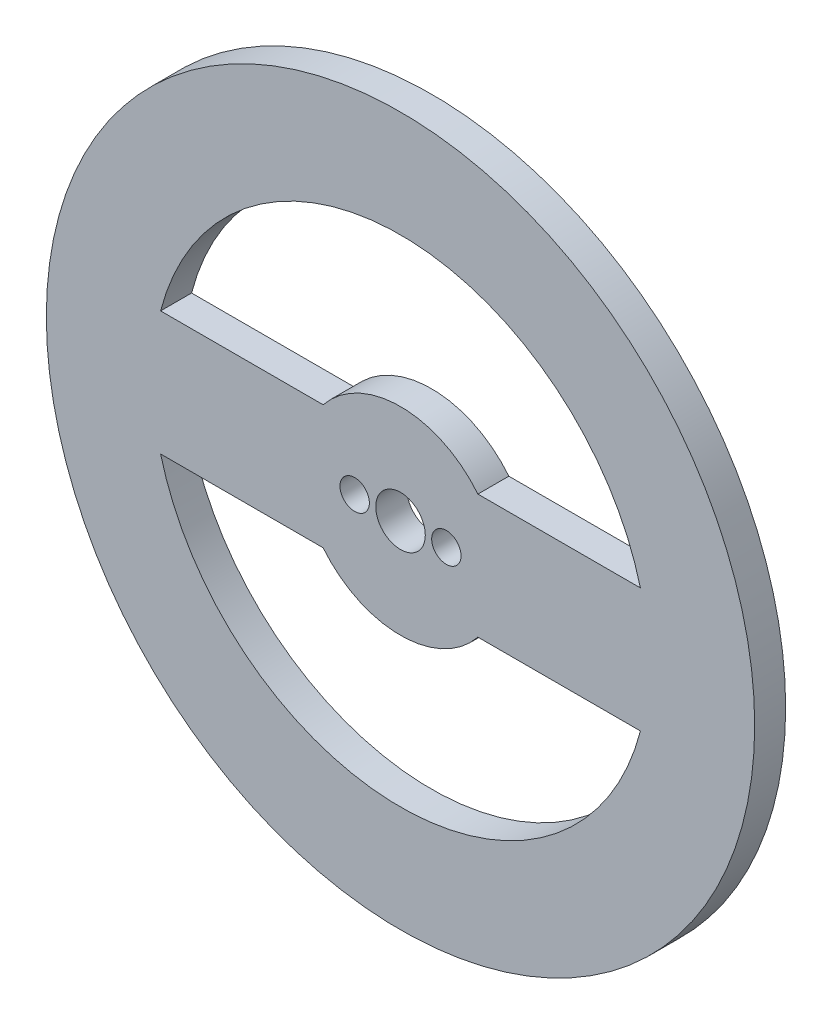
from build123d import *

# Parameters (mm, degrees)
SKETCH1_R           = 36.3093
BOSS_EXTRUDE1_DEPTH = 3.175
CUT_EXTRUDE1_DEPTH  = 52.44716861
SKETCH3_R           = 1.505
SKETCH3_R_2         = 2.54
CUT_EXTRUDE2_DEPTH  = 52.44716861


with BuildPart() as part:
    # Sketch1 → Boss-Extrude1 (new body)
    with BuildSketch(Plane.XY):
        Circle(SKETCH1_R)
    extrude(amount=BOSS_EXTRUDE1_DEPTH)

    # Sketch2 → Cut-Extrude1 (cut, through all)
    with BuildSketch(Plane.XY.offset(3.175)):
        with BuildLine():
            Line((-24.593444248, -6.35), (-7.931147458, -6.35))
            ThreePointArc((-7.931147458, -6.35), (0, -10.16), (7.931147458, -6.35))
            Line((7.931147458, -6.35), (24.593444248, -6.35))
            ThreePointArc((24.593444248, -6.35), (0, -25.4), (-24.593444248, -6.35))
        make_face()
        with BuildLine():
            Line((7.931147458, 6.35), (24.593444248, 6.35))
            ThreePointArc((24.593444248, 6.35), (0, 25.4), (-24.593444248, 6.35))
            Line((-24.593444248, 6.35), (-7.931147458, 6.35))
            ThreePointArc((-7.931147458, 6.35), (0, 10.16), (7.931147458, 6.35))
        make_face()
    extrude(amount=-CUT_EXTRUDE1_DEPTH, mode=Mode.SUBTRACT)

    # Sketch3 → Cut-Extrude2 (cut, through all)
    with BuildSketch(Plane.XY.offset(3.175)):
        with Locations((-4.699, 0)):
            Circle(SKETCH3_R)
        with Locations((4.699, 0)):
            Circle(SKETCH3_R)
        Circle(SKETCH3_R_2)
    extrude(amount=-CUT_EXTRUDE2_DEPTH, mode=Mode.SUBTRACT)


solid = part.part
